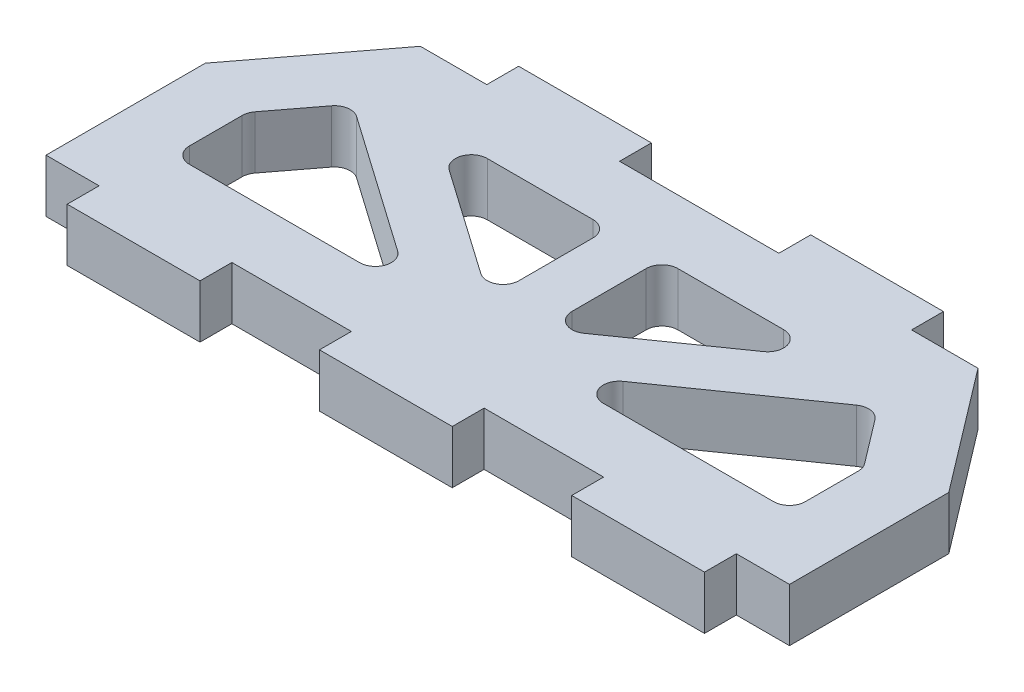
from build123d import *

# Parameters (mm, degrees)
EXTRUDE_1_DEPTH = 5
FILLET_1_R      = 1.5


with BuildPart() as part:
    # 草图1 → 凸台-拉伸1 (new body)
    with BuildSketch(Plane(origin=(0, 0, 0), x_dir=(1, 0, 0), z_dir=(0, 1, 0))):
        Polygon((6.25, -9.219059406), (-6.25, -9.219059406), (-6.25, -6.219059406), (-17.5, -6.219059406), (-17.5, -9.219059406), (-30, -9.219059406), (-30, -6.219059406), (-35, -6.219059406), (-35, 8.780940594), (-26.25, 20.280940594), (-20, 20.280940594), (-20, 23.280940594), (-7.5, 23.280940594), (-7.5, 20.280940594), (7.5, 20.280940594), (7.5, 23.280940594), (20, 23.280940594), (20, 20.280940594), (26.25, 20.280940594), (35, 8.780940594), (35, -6.219059406), (30, -6.219059406), (30, -9.219059406), (17.5, -9.219059406), (17.5, -6.219059406), (6.25, -6.219059406), align=None)
        Polygon((-29, 6.757846183), (-24.718664622, 12.384744108), (-6.718567757, -0.219059406), (-29, -0.219059406), align=None, mode=Mode.SUBTRACT)
        Polygon((-18.709479877, 14.280940594), (-2.5, 2.930940594), (-2.5, 14.280940594), align=None, mode=Mode.SUBTRACT)
        Polygon((2.5, 14.280940594), (18.709479877, 14.280940594), (2.5, 2.930940594), align=None, mode=Mode.SUBTRACT)
        Polygon((6.718567757, -0.219059406), (24.718664622, 12.384744108), (29, 6.757846183), (29, -0.219059406), align=None, mode=Mode.SUBTRACT)
    extrude(amount=EXTRUDE_1_DEPTH)

    # 圆角1
    fillet_1_edges = [part.edges().sort_by_distance(p)[0] for p in [
        (29, 2.5, 0.219059406),
        (29, 2.5, -6.757846183),
        (24.718664622, 2.5, -12.384744108),
        (-2.5, 2.5, -14.280940594),
        (-18.709479877, 2.5, -14.280940594),
        (-2.5, 2.5, -2.930940594),
        (-6.718567757, 2.5, 0.219059406),
        (-24.718664622, 2.5, -12.384744108),
        (-29, 2.5, -6.757846183),
        (-29, 2.5, 0.219059406),
        (2.5, 2.5, -14.280940594),
        (2.5, 2.5, -2.930940594),
        (18.709479877, 2.5, -14.280940594),
        (6.718567757, 2.5, 0.219059406),
    ]]
    fillet(fillet_1_edges, radius=FILLET_1_R)


solid = part.part
